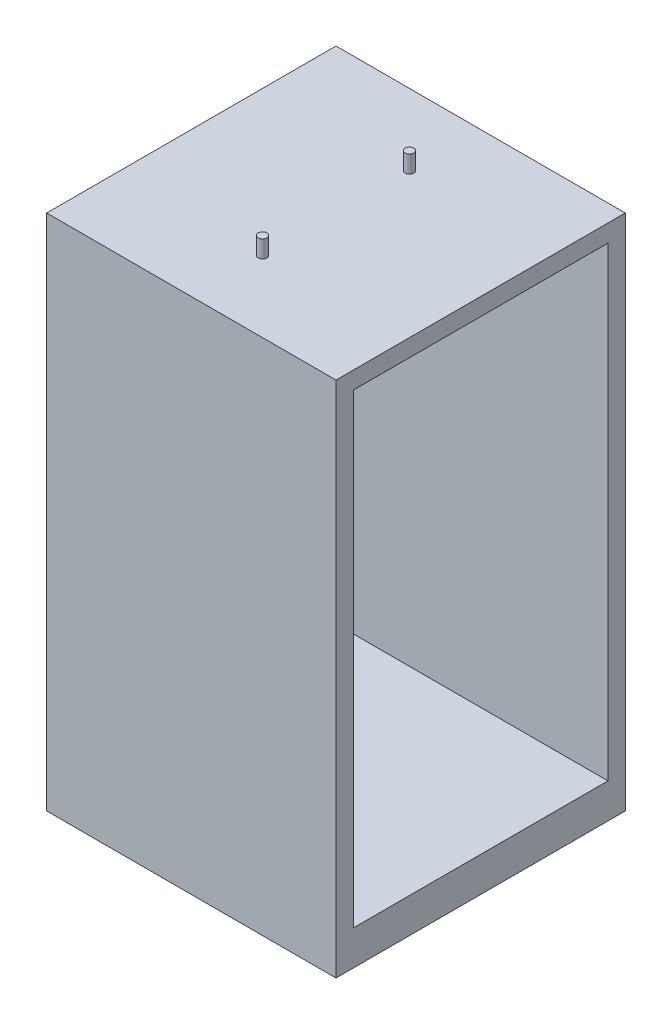
from build123d import *

# Parameters (mm, degrees)
SKETCH1_W           = 50
SKETCH1_H           = 50
BOSS_EXTRUDE2_DEPTH = 89.5
SKETCH4_W           = 44
SKETCH4_H           = 80.5
CUT_EXTRUDE1_DEPTH  = 89.5
SKETCH5_R           = 0.75
CUT_EXTRUDE2_DEPTH  = 3
SKETCH6_R           = 0.75
BOSS_EXTRUDE4_DEPTH = 3


with BuildPart() as part:
    # Sketch1 → Boss-Extrude2 (new body)
    with BuildSketch(Plane(origin=(0, 0, 0), x_dir=(1, 0, 0), z_dir=(0, 1, 0))):
        with Locations((-3.165306342, -9.606735536)):
            Rectangle(SKETCH1_W, SKETCH1_H)
    extrude(amount=BOSS_EXTRUDE2_DEPTH)

    # Sketch4 → Cut-Extrude1 (cut)
    with BuildSketch(Plane(origin=(21.834693658, 0, 0), x_dir=(0, 0, -1), z_dir=(1, 0, 0))):
        with Locations((-9.606735536, 46.25)):
            Rectangle(SKETCH4_W, SKETCH4_H)
    extrude(amount=-CUT_EXTRUDE1_DEPTH, mode=Mode.SUBTRACT)

    # Sketch5 → Cut-Extrude2 (cut)
    with BuildSketch(Plane(origin=(0, 0, 0), x_dir=(-1, 0, 0), z_dir=(0, -1, 0))):
        with Locations(Location((3.165306342, -22.306735536, 0), (0, 0, 90))):
            Circle(SKETCH5_R)
        with Locations(Location((3.165306342, 3.093264464, 0), (0, 0, 90))):
            Circle(SKETCH5_R)
    extrude(amount=-CUT_EXTRUDE2_DEPTH, mode=Mode.SUBTRACT)

    # Sketch6 → Boss-Extrude4 (add)
    with BuildSketch(Plane(origin=(0, 89.5, 0), x_dir=(1, 0, 0), z_dir=(0, 1, 0))):
        with Locations(Location((-3.165306342, 3.093264464, 0), (0, 0, 90))):
            Circle(SKETCH6_R)
        with Locations(Location((-3.165306342, -22.306735536, 0), (0, 0, 90))):
            Circle(SKETCH6_R)
    extrude(amount=BOSS_EXTRUDE4_DEPTH)


solid = part.part
